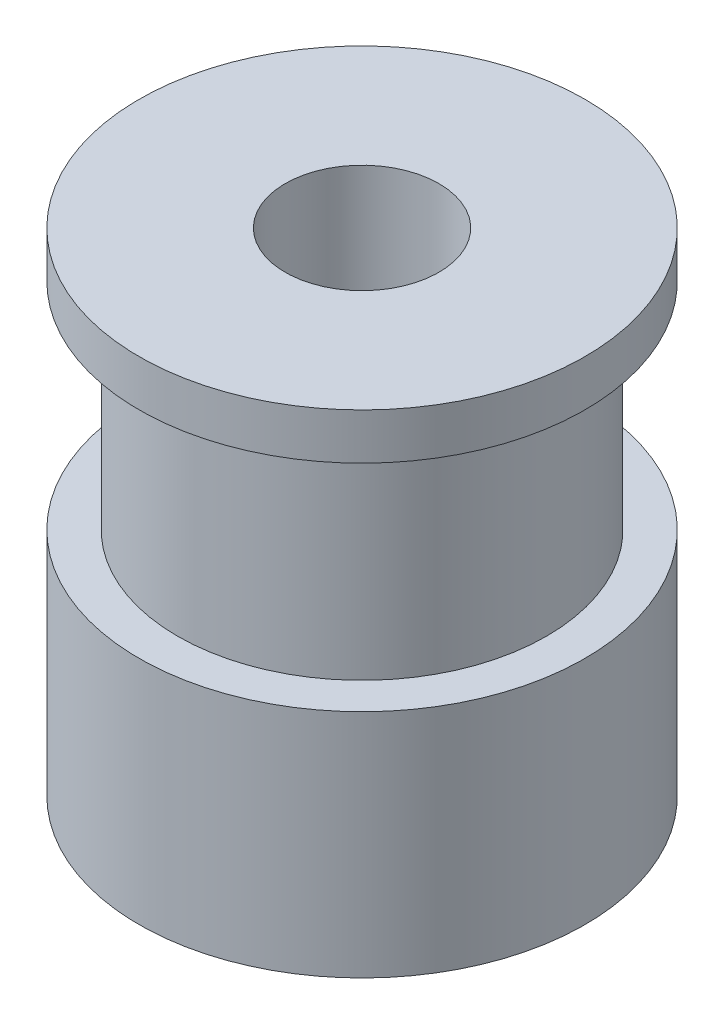
from build123d import *


with BuildPart() as part:
    # Эскиз3 → Повернуть1 (revolve)
    with BuildSketch(Plane.XY, mode=Mode.PRIVATE) as revolve_1_sk:
        Polygon((2.5, 0), (2.5, 16), (7.25, 16), (7.25, 14.5), (6, 14.5), (6, 7.5), (7.25, 7.5), (7.25, 0), align=None)
    revolve(revolve_1_sk.sketch.rotate(Axis((0, 0, 0), (0, 1, 0)), 90), axis=Axis((0, 0, 0), (0, 1, 0)))


solid = part.part
